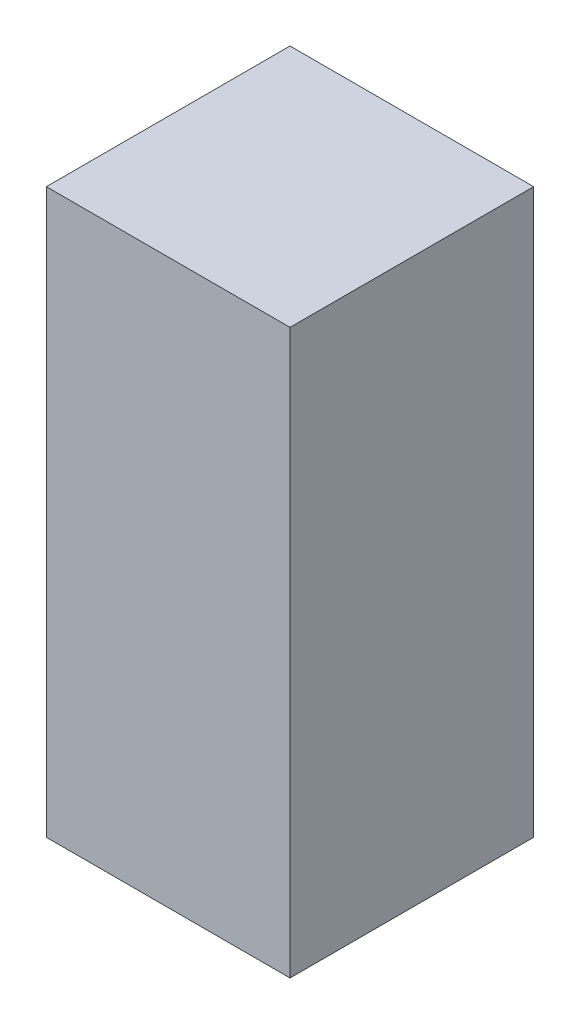
from build123d import *

# Parameters (mm, degrees)
SKETCH1_W           = 80
SKETCH1_H           = 185
BOSS_EXTRUDE1_DEPTH = 80


with BuildPart() as part:
    # Sketch1 → Boss-Extrude1 (new body)
    with BuildSketch(Plane.XY.offset(12)):
        with Locations((0, 44)):
            Rectangle(SKETCH1_W, SKETCH1_H)
    extrude(amount=-BOSS_EXTRUDE1_DEPTH)


solid = part.part
